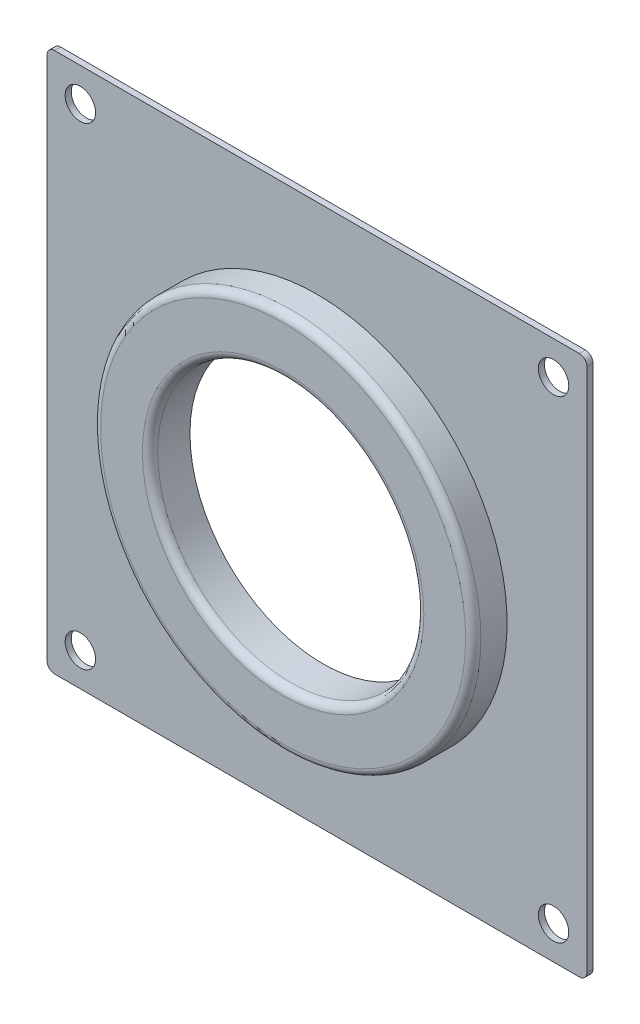
from build123d import *

# Parameters (mm, degrees)
SKETCH_1_W            = 71
SKETCH_1_H            = 71
EXTRUDE_1_DEPTH       = 0.8
SKETCH_2_W            = 25
SKETCH_2_H            = 4.45
HOLE_WIZARD_M30_1_D   = 35
HOLE_WIZARD_4_0_4_1_D = 4
FILLET_1_R            = 1
FILLET_2_R            = 10
EXTRUDE_START         = -0.8
SKETCH_9_R            = 17.5
EXTRUDE_3_DEPTH       = 0.8
CUT_EXTRUDE_1_REACH   = 52.401
SKETCH_8_R            = 2


with BuildPart() as part:
    # 草图1 → 凸台-拉伸1 (new body)
    with BuildSketch(Plane.XY.offset(1)):
        Rectangle(SKETCH_1_W, SKETCH_1_H)
    extrude(amount=-EXTRUDE_1_DEPTH)

    # 草图2 → 旋转1 (revolve)
    with BuildSketch(Plane.XZ, mode=Mode.PRIVATE) as revolve_1_sk:
        with Locations((12.5, 3.225)):
            Rectangle(SKETCH_2_W, SKETCH_2_H)
    revolve(revolve_1_sk.sketch.rotate(Axis((0, 0, 5.45), (0, 0, -1)), 180), axis=Axis((0, 0, 5.45), (0, 0, -1)))

    # M30 间隙孔1 (through all)
    with Locations(Plane.XY.offset(5.45)):
        with Locations((0, 0)):
            Hole(HOLE_WIZARD_M30_1_D / 2)

    # Ø4.0 (4) 直径孔1 (through all)
    with Locations(Plane.XY.offset(1)):
        with Locations((-29, 29), (-29, -29), (29, -29), (29, 29)):
            Hole(HOLE_WIZARD_4_0_4_1_D / 2)

    # 圆角1
    fillet_1_edges = [part.edges().sort_by_distance(p)[0] for p in [
        (25, 0, 5.45),
        (17.5, 0, 5.45),
    ]]
    fillet(fillet_1_edges, radius=FILLET_1_R)

    # 圆角2
    fillet_2_edges = [part.edges().sort_by_distance(p)[0] for p in [
        (35.5, 35.5, 0.6),
        (35.5, -35.5, 0.6),
        (-35.5, -35.5, 0.6),
        (-35.5, 35.5, 0.6),
    ]]
    fillet(fillet_2_edges, radius=FILLET_2_R)

    # 草图9 → 凸台-拉伸3 (add)
    with BuildSketch(Plane.XY.offset(1).offset(EXTRUDE_START)):
        with BuildLine():
            Line((-34.5, 35.5), (34.5, 35.5))
            ThreePointArc((34.5, 35.5), (35.207106781, 35.207106781), (35.5, 34.5))
            Line((35.5, 34.5), (35.5, -34.5))
            ThreePointArc((35.5, -34.5), (35.207106781, -35.207106781), (34.5, -35.5))
            Line((34.5, -35.5), (-34.5, -35.5))
            ThreePointArc((-34.5, -35.5), (-35.207106781, -35.207106781), (-35.5, -34.5))
            Line((-35.5, -34.5), (-35.5, 34.5))
            ThreePointArc((-35.5, 34.5), (-35.207106781, 35.207106781), (-34.5, 35.5))
        make_face()
        Circle(SKETCH_9_R, mode=Mode.SUBTRACT)
    extrude(amount=EXTRUDE_3_DEPTH)

    # 草图8 → 切除-拉伸1 (cut, up to next)
    with BuildSketch(Plane.XY.offset(1), mode=Mode.PRIVATE) as cut_extrude_1_sk1:
        with Locations((-31.112698372, 31.112698372)):
            Circle(SKETCH_8_R)
    cut_extrude_1_tool1 = extrude(cut_extrude_1_sk1.sketch, amount=-CUT_EXTRUDE_1_REACH, mode=Mode.PRIVATE) & part.part
    # 草图8 → 切除-拉伸1 (cut, up to next)
    with BuildSketch(Plane.XY.offset(1), mode=Mode.PRIVATE) as cut_extrude_1_sk2:
        with Locations((31.112698372, -31.112698372)):
            Circle(SKETCH_8_R)
    cut_extrude_1_tool2 = extrude(cut_extrude_1_sk2.sketch, amount=-CUT_EXTRUDE_1_REACH, mode=Mode.PRIVATE) & part.part
    # 草图8 → 切除-拉伸1 (cut, up to next)
    with BuildSketch(Plane.XY.offset(1), mode=Mode.PRIVATE) as cut_extrude_1_sk3:
        with Locations((-31.112698372, -31.112698372)):
            Circle(SKETCH_8_R)
    cut_extrude_1_tool3 = extrude(cut_extrude_1_sk3.sketch, amount=-CUT_EXTRUDE_1_REACH, mode=Mode.PRIVATE) & part.part
    # 草图8 → 切除-拉伸1 (cut, up to next)
    with BuildSketch(Plane.XY.offset(1), mode=Mode.PRIVATE) as cut_extrude_1_sk4:
        with Locations((31.112698372, 31.112698372)):
            Circle(SKETCH_8_R)
    cut_extrude_1_tool4 = extrude(cut_extrude_1_sk4.sketch, amount=-CUT_EXTRUDE_1_REACH, mode=Mode.PRIVATE) & part.part
    add(cut_extrude_1_tool1.solids().sort_by_distance((-31.112698, 31.112698, 1))[0], mode=Mode.SUBTRACT)
    add(cut_extrude_1_tool2.solids().sort_by_distance((31.112698, -31.112698, 1))[0], mode=Mode.SUBTRACT)
    add(cut_extrude_1_tool3.solids().sort_by_distance((-31.112698, -31.112698, 1))[0], mode=Mode.SUBTRACT)
    add(cut_extrude_1_tool4.solids().sort_by_distance((31.112698, 31.112698, 1))[0], mode=Mode.SUBTRACT)


solid = part.part
